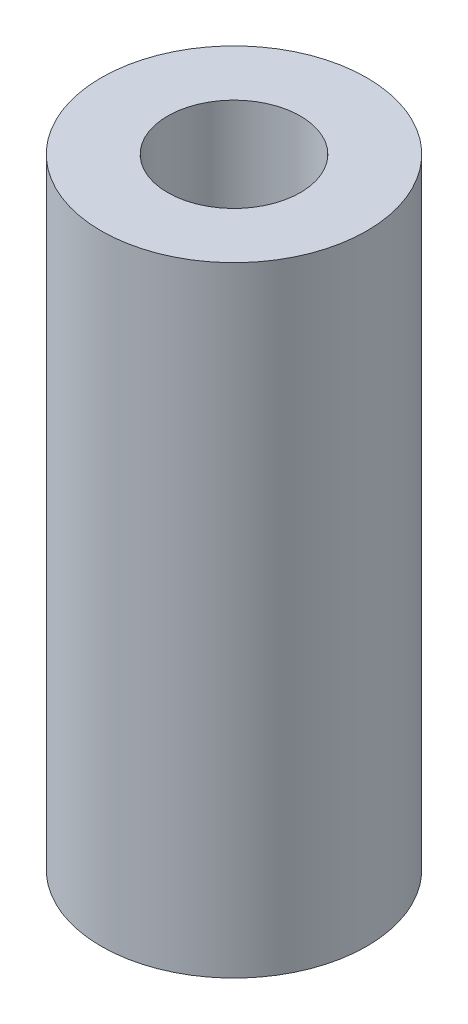
from build123d import *

# Parameters (mm, degrees)
SKETCH_1_R      = 6
SKETCH_1_R_2    = 3
EXTRUDE_1_DEPTH = 28


with BuildPart() as part:
    # 草图1 → 凸台-拉伸1 (new body)
    with BuildSketch(Plane(origin=(0, 0, 0), x_dir=(1, 0, 0), z_dir=(0, 1, 0))):
        with Locations(Location((0, 0, 0), (0, 0, 270))):
            Circle(SKETCH_1_R)
        with Locations(Location((0, 0, 0), (0, 0, 270))):
            Circle(SKETCH_1_R_2, mode=Mode.SUBTRACT)
    extrude(amount=EXTRUDE_1_DEPTH)


solid = part.part
